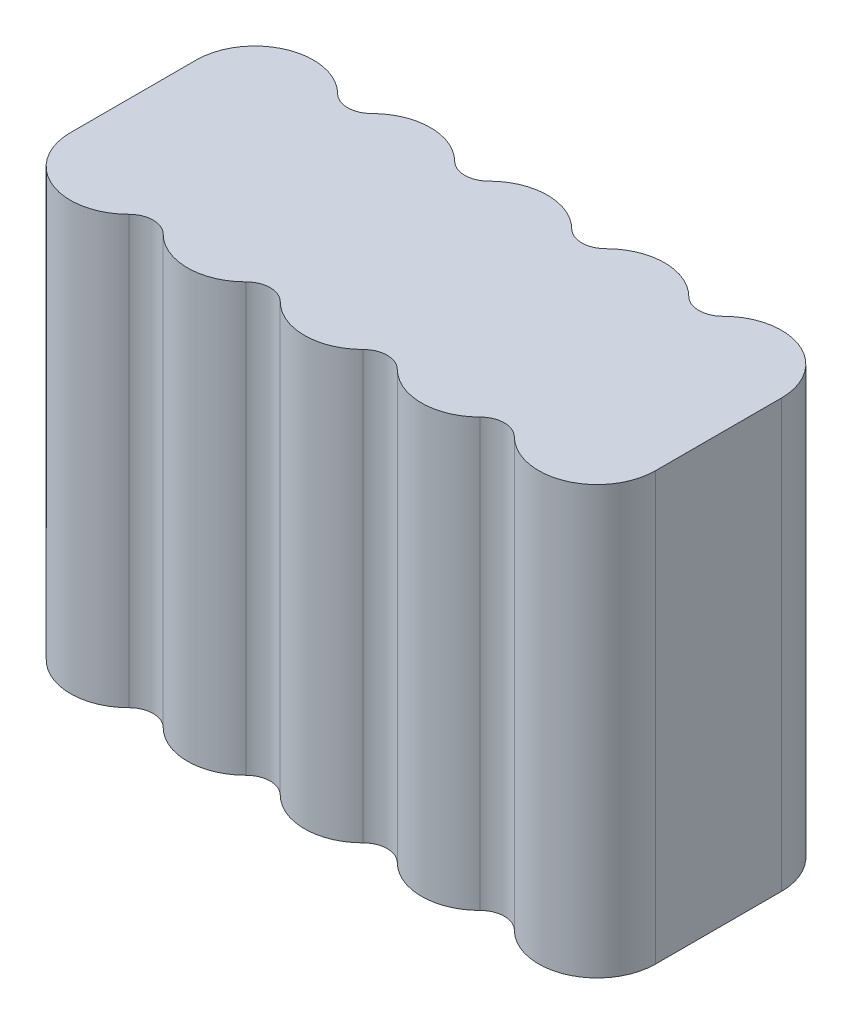
from build123d import *

# Parameters (mm, degrees)
BOSS_EXTRUDE1_DEPTH = 53.594


with BuildPart() as part:
    # Sketch1 → Boss-Extrude1 (new body)
    with BuildSketch(Plane(origin=(0, 0, 0), x_dir=(1, 0, 0), z_dir=(0, 1, 0))):
        with BuildLine():
            Line((0, 23.139), (0, 7.341))
            ThreePointArc((0, 7.341), (4.531605435, 0.55884819), (12.531694095, 2.14995234))
            ThreePointArc((12.531694095, 2.14995234), (14.6815, 3.040388214), (16.831305905, 2.14995234))
            ThreePointArc((16.831305905, 2.14995234), (22.022, 0), (27.212694095, 2.14995234))
            ThreePointArc((27.212694095, 2.14995234), (29.3625, 3.040388214), (31.512305905, 2.14995234))
            ThreePointArc((31.512305905, 2.14995234), (36.703, 0), (41.893694095, 2.14995234))
            ThreePointArc((41.893694095, 2.14995234), (44.0435, 3.040388214), (46.193305905, 2.14995234))
            ThreePointArc((46.193305905, 2.14995234), (51.384, 0), (56.574694095, 2.14995234))
            ThreePointArc((56.574694095, 2.14995234), (58.7245, 3.040388214), (60.874305905, 2.14995234))
            ThreePointArc((60.874305905, 2.14995234), (68.874394565, 0.55884819), (73.406, 7.341))
            Line((73.406, 7.341), (73.406, 23.139))
            ThreePointArc((73.406, 23.139), (68.874394565, 29.92115181), (60.874305905, 28.33004766))
            ThreePointArc((60.874305905, 28.33004766), (58.7245, 27.439611786), (56.574694095, 28.33004766))
            ThreePointArc((56.574694095, 28.33004766), (51.384, 30.48), (46.193305905, 28.33004766))
            ThreePointArc((46.193305905, 28.33004766), (44.0435, 27.439611786), (41.893694095, 28.33004766))
            ThreePointArc((41.893694095, 28.33004766), (36.703, 30.48), (31.512305905, 28.33004766))
            ThreePointArc((31.512305905, 28.33004766), (29.3625, 27.439611786), (27.212694095, 28.33004766))
            ThreePointArc((27.212694095, 28.33004766), (22.022, 30.48), (16.831305905, 28.33004766))
            ThreePointArc((16.831305905, 28.33004766), (14.6815, 27.439611786), (12.531694095, 28.33004766))
            ThreePointArc((12.531694095, 28.33004766), (4.531605435, 29.92115181), (0, 23.139))
        make_face()
        with BuildLine():
            ThreePointArc((14.6815, 23.053321823), (14.682, 23.139), (14.6815, 23.224678177))
            ThreePointArc((14.6815, 23.224678177), (14.681, 23.139), (14.6815, 23.053321823))
        make_face(mode=Mode.SUBTRACT)
        with BuildLine():
            ThreePointArc((29.3625, 23.053321823), (29.363, 23.139), (29.3625, 23.224678177))
            ThreePointArc((29.3625, 23.224678177), (29.362, 23.139), (29.3625, 23.053321823))
        make_face(mode=Mode.SUBTRACT)
        with BuildLine():
            ThreePointArc((14.6815, 7.426678177), (14.681, 7.341), (14.6815, 7.255321823))
            ThreePointArc((14.6815, 7.255321823), (14.682, 7.341), (14.6815, 7.426678177))
        make_face(mode=Mode.SUBTRACT)
        with BuildLine():
            ThreePointArc((44.0435, 23.053321823), (44.044, 23.139), (44.0435, 23.224678177))
            ThreePointArc((44.0435, 23.224678177), (44.043, 23.139), (44.0435, 23.053321823))
        make_face(mode=Mode.SUBTRACT)
        with BuildLine():
            ThreePointArc((29.3625, 7.426678177), (29.362, 7.341), (29.3625, 7.255321823))
            ThreePointArc((29.3625, 7.255321823), (29.363, 7.341), (29.3625, 7.426678177))
        make_face(mode=Mode.SUBTRACT)
        with BuildLine():
            ThreePointArc((58.7245, 23.053321823), (58.725, 23.139), (58.7245, 23.224678177))
            ThreePointArc((58.7245, 23.224678177), (58.724, 23.139), (58.7245, 23.053321823))
        make_face(mode=Mode.SUBTRACT)
        with BuildLine():
            ThreePointArc((44.0435, 7.426678177), (44.043, 7.341), (44.0435, 7.255321823))
            ThreePointArc((44.0435, 7.255321823), (44.044, 7.341), (44.0435, 7.426678177))
        make_face(mode=Mode.SUBTRACT)
        with BuildLine():
            ThreePointArc((58.7245, 7.426678177), (58.724, 7.341), (58.7245, 7.255321823))
            ThreePointArc((58.7245, 7.255321823), (58.725, 7.341), (58.7245, 7.426678177))
        make_face(mode=Mode.SUBTRACT)
    extrude(amount=BOSS_EXTRUDE1_DEPTH)


solid = part.part
